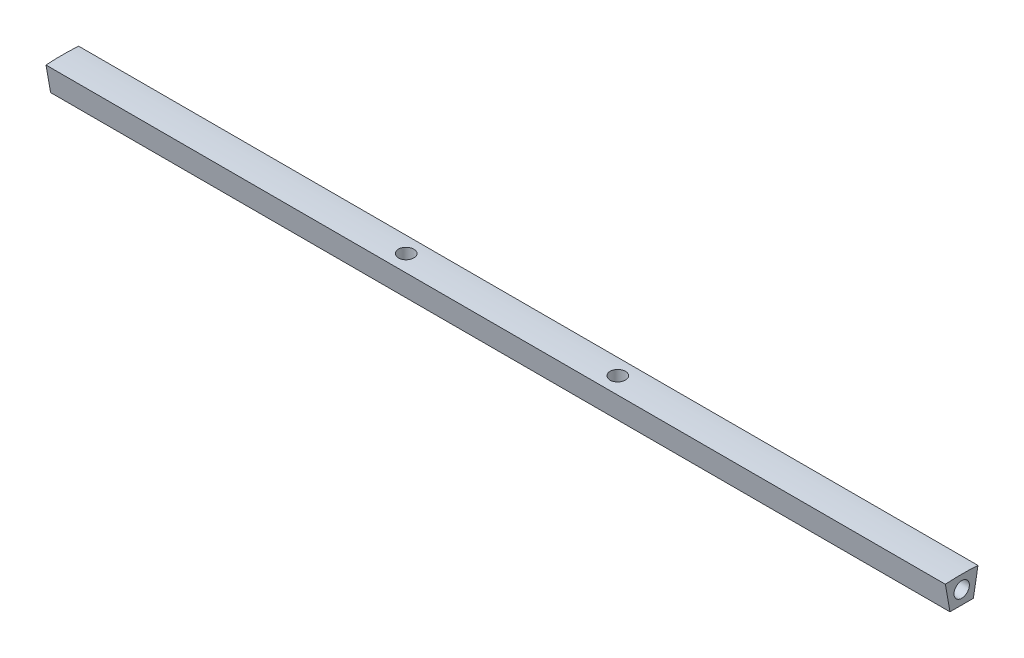
from build123d import *

# Parameters (mm, degrees)
EXTRUDE_1_DEPTH     = 85
SKETCH_2_R          = 1.45
CUT_EXTRUDE_1_DEPTH = 10
SKETCH_3_R          = 1.45
CUT_EXTRUDE_2_DEPTH = 10


with BuildPart() as part:
    # Эскиз1 → Бобышка-Вытянуть1 (new, symmetric)
    with BuildSketch(Plane(origin=(0, 0, 0), x_dir=(0, 0, -1), z_dir=(1, 0, 0))):
        with BuildLine():
            Line((-3.085485457, 17.498657575), (-2.211734297, 12.543368507))
            Line((-2.211734297, 12.543368507), (2.211734297, 12.543368507))
            Line((2.211734297, 12.543368507), (3.085485457, 17.498657575))
            ThreePointArc((3.085485457, 17.498657575), (0, 17.604562424), (-3.085485457, 17.498657575))
        make_face()
    extrude(amount=EXTRUDE_1_DEPTH, both=True)

    # Эскиз2 → Вырез-Вытянуть1 (cut)
    with BuildSketch(Plane(origin=(85, 0, 0), x_dir=(0, 0, -1), z_dir=(1, 0, 0))):
        with Locations((0, 15.104562424)):
            Circle(SKETCH_2_R)
    cut_extrude_1 = extrude(amount=-CUT_EXTRUDE_1_DEPTH, mode=Mode.SUBTRACT)

    # Зеркальное отражение1: Вырез-Вытянуть1 across plane
    add(cut_extrude_1.mirror(Plane(origin=(0, 0, 0), x_dir=(0, 0, 1), z_dir=(1, 0, 0))), mode=Mode.SUBTRACT)

    # Эскиз3 → Вырез-Вытянуть2 (cut)
    with BuildSketch(Plane.XZ.offset(-12.543368507)):
        with Locations(Location((-20, 0, 0), (0, 0, 270))):
            Circle(SKETCH_3_R)
        with Locations(Location((20, 0, 0), (0, 0, 270))):
            Circle(SKETCH_3_R)
    extrude(amount=-CUT_EXTRUDE_2_DEPTH, mode=Mode.SUBTRACT)


solid = part.part
